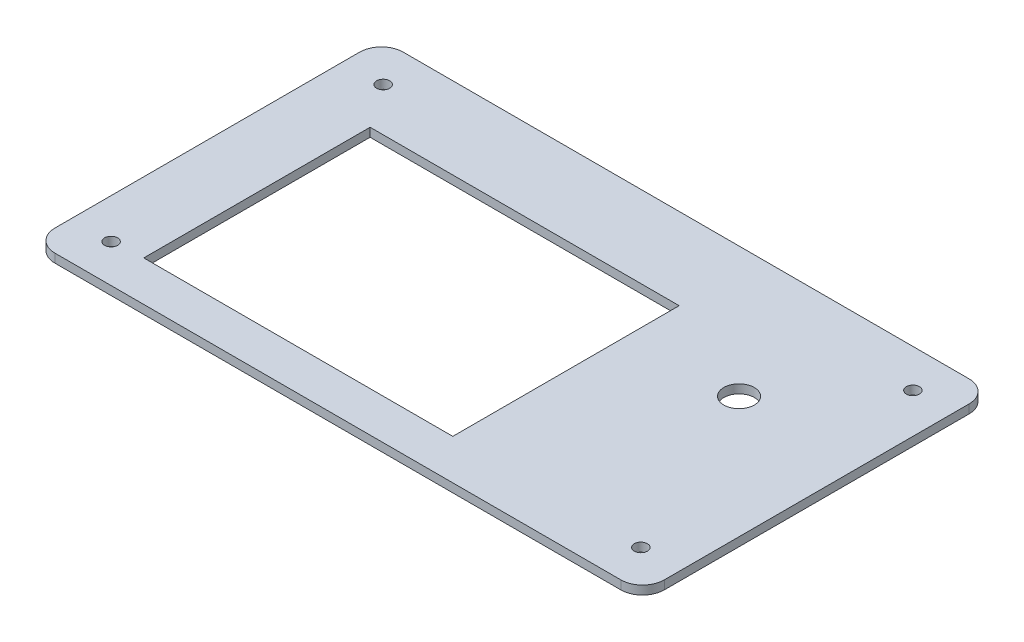
from build123d import *

# Parameters (mm, degrees)
SKETCH2_R           = 1.5
SKETCH2_R_2         = 3.5
SKETCH2_W           = 71
SKETCH2_H           = 52
BOSS_EXTRUDE1_DEPTH = 2


with BuildPart() as part:
    # Sketch2 → Boss-Extrude1 (new body)
    with BuildSketch(Plane(origin=(0, 0, 0), x_dir=(1, 0, 0), z_dir=(0, 1, 0))):
        with BuildLine():
            Line((-62.225750218, 38.541254469), (67.774249782, 38.541254469))
            ThreePointArc((67.774249782, 38.541254469), (71.309783688, 37.076788375), (72.774249782, 33.541254469))
            Line((72.774249782, 33.541254469), (72.774249782, -36.458745531))
            ThreePointArc((72.774249782, -36.458745531), (71.309783688, -39.994279437), (67.774249782, -41.458745531))
            Line((67.774249782, -41.458745531), (-62.225750218, -41.458745531))
            ThreePointArc((-62.225750218, -41.458745531), (-65.761284124, -39.994279437), (-67.225750218, -36.458745531))
            Line((-67.225750218, -36.458745531), (-67.225750218, 33.541254469))
            ThreePointArc((-67.225750218, 33.541254469), (-65.761284124, 37.076788375), (-62.225750218, 38.541254469))
        make_face()
        with Locations(Location((-58.075750218, 29.791254469, 0), (0, 0, 270))):
            Circle(SKETCH2_R, mode=Mode.SUBTRACT)
        with Locations(Location((63.624249782, 29.791254469, 0), (0, 0, 270))):
            Circle(SKETCH2_R, mode=Mode.SUBTRACT)
        with Locations(Location((-58.075750218, -32.708745531, 0), (0, 0, 270))):
            Circle(SKETCH2_R, mode=Mode.SUBTRACT)
        with Locations(Location((63.624249782, -32.708745531, 0), (0, 0, 270))):
            Circle(SKETCH2_R, mode=Mode.SUBTRACT)
        with Locations(Location((44.830013856, 8.6487321, 0), (0, 0, 270))):
            Circle(SKETCH2_R_2, mode=Mode.SUBTRACT)
        with Locations((-15.575750218, -6.208745531)):
            Rectangle(SKETCH2_W, SKETCH2_H, mode=Mode.SUBTRACT)
    extrude(amount=BOSS_EXTRUDE1_DEPTH)


solid = part.part
